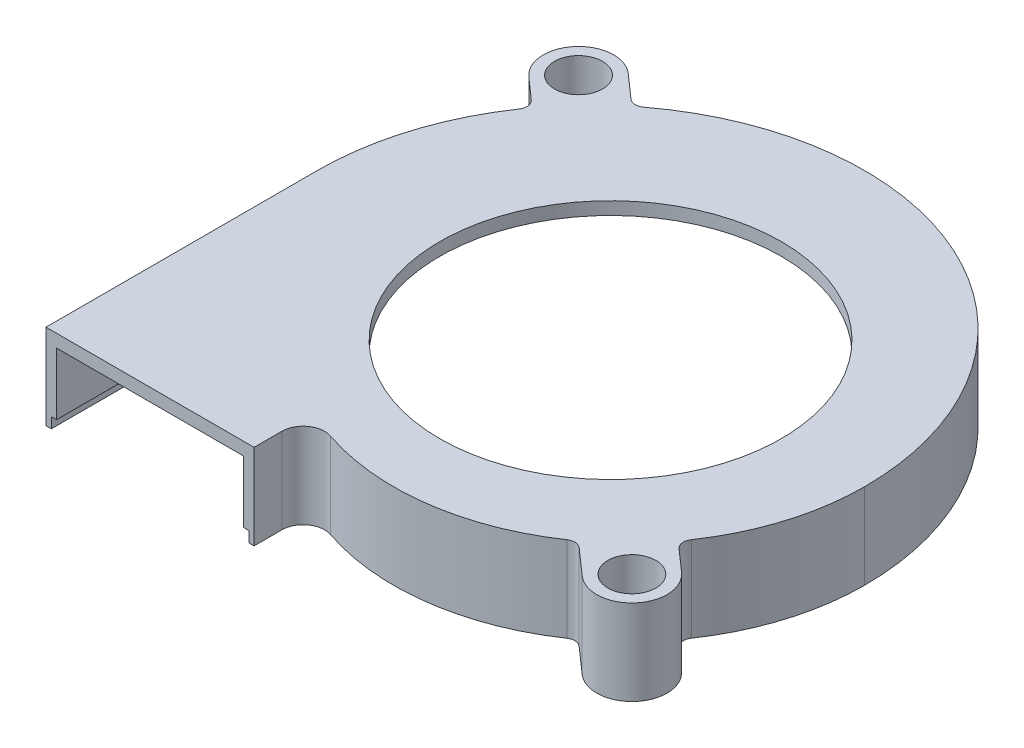
from build123d import *

# Parameters (mm, degrees)
SKETCH_1_R          = 16
SKETCH_1_R_2        = 2.25
EXTRUDE_1_DEPTH     = 8
CUT_EXTRUDE_1_DEPTH = 6.8
CUT_EXTRUDE_8_DEPTH = 1


with BuildPart() as part:
    # Эскиз1 → Бобышка-Вытянуть1 (new body)
    with BuildSketch(Plane(origin=(0, 0, 0), x_dir=(1, 0, 0), z_dir=(0, 1, 0))):
        with BuildLine():
            Line((-27.5, -25.4), (-8, -25.4))
            Line((-8, -25.4), (-8, -22.792302991))
            ThreePointArc((-8, -22.792302991), (-7.16511566, -21.166724479), (-5.357494501, -20.89831601))
            ThreePointArc((-5.357494501, -20.89831601), (4.710003701, -21.866199594), (14.151976117, -18.241220202))
            ThreePointArc((14.151976117, -18.241220202), (14.777726241, -18.069792078), (15.376980036, -18.318480053))
            Line((15.376980036, -18.318480053), (17.814747272, -20.472785982))
            ThreePointArc((17.814747272, -20.472785982), (22.472785982, -20.185252728), (22.185252728, -15.527214018))
            Line((22.185252728, -15.527214018), (20.143734708, -13.723081814))
            ThreePointArc((20.143734708, -13.723081814), (19.813719174, -13.098302749), (19.979075206, -12.411340949))
            ThreePointArc((19.979075206, -12.411340949), (22.823148445, -6.493089604), (23.8, 0))
            ThreePointArc((23.8, 0), (9.576401492, 22.98111988), (-17.333078903, 20.466663618))
            ThreePointArc((-17.333078903, 20.466663618), (-17.974550182, 20.264645495), (-18.598905377, 20.514600122))
            Line((-18.598905377, 20.514600122), (-20.814747272, 22.472785982))
            ThreePointArc((-20.814747272, 22.472785982), (-25.472785982, 22.185252728), (-25.185252728, 17.527214018))
            Line((-25.185252728, 17.527214018), (-23.20688118, 15.778885673))
            ThreePointArc((-23.20688118, 15.778885673), (-22.876796583, 15.153555184), (-23.04284729, 14.466226133))
            ThreePointArc((-23.04284729, 14.466226133), (-26.362874376, 7.569397218), (-27.5, 0))
            Line((-27.5, 0), (-27.5, -25.4))
        make_face()
        with Locations(Location((0, 0, 0), (0, 0, 270))):
            Circle(SKETCH_1_R, mode=Mode.SUBTRACT)
        with Locations(Location((-23, 20, 0), (0, 0, 270))):
            Circle(SKETCH_1_R_2, mode=Mode.SUBTRACT)
        with Locations(Location((20, -18, 0), (0, 0, 270))):
            Circle(SKETCH_1_R_2, mode=Mode.SUBTRACT)
    extrude(amount=-EXTRUDE_1_DEPTH)

    # Эскиз2 → Вырез-Вытянуть1 (cut)
    with BuildSketch(Plane(origin=(0, -8, 0), x_dir=(-1, 0, 0), z_dir=(0, -1, 0))):
        with BuildLine():
            Line((9, -25.4), (9, -22.792302991))
            ThreePointArc((9, -22.792302991), (7.74767349, -20.353935223), (5.036241751, -19.95132252))
            ThreePointArc((5.036241751, -19.95132252), (-4.575054369, -20.875347093), (-13.589169994, -17.414631267))
            ThreePointArc((-13.589169994, -17.414631267), (-16.632858543, -14.893819788), (-19.152217909, -11.84892917))
            ThreePointArc((-19.152217909, -11.84892917), (-21.867461922, -6.198703298), (-22.799999997, 0.000326884))
            ThreePointArc((-22.799999997, 0.000326884), (-9.131074658, 22.085751778), (16.729450225, 19.669398029))
            ThreePointArc((16.729450225, 19.669398029), (19.707335368, 17.009099388), (22.216615604, 13.902895678))
            ThreePointArc((22.216615604, 13.902895678), (25.407255273, 7.274792502), (26.500000107, 0.000327424))
            Line((26.500000107, 0.000327424), (26.5, -25.4))
            Line((26.5, -25.4), (9, -25.4))
        make_face()
    extrude(amount=-CUT_EXTRUDE_1_DEPTH, mode=Mode.SUBTRACT)

    # Эскиз11 → Вырез-Вытянуть8 (cut)
    with BuildSketch(Plane.XZ.offset(8)):
        with BuildLine():
            Line((-9, 22.792302991), (-9, 25.4))
            Line((-9, 25.4), (-8.5, 25.4))
            Line((-8.5, 25.4), (-8.5, 22.792302991))
            ThreePointArc((-8.5, 22.792302991), (-7.456394575, 20.760329851), (-5.196868126, 20.424819265))
            ThreePointArc((-5.196868126, 20.424819265), (14.296629108, 17.530257554), (23.3, -0.000122775))
            ThreePointArc((23.3, -0.000122775), (-1.849981192, -25.16680236), (-26.999999983, -0.000160392))
            Line((-26.999999983, -0.000160392), (-27.000000053, 25.4))
            Line((-27.000000053, 25.4), (-26.500000054, 25.4))
            Line((-26.500000054, 25.4), (-26.500000053, -0.000327424))
            ThreePointArc((-26.500000053, -0.000327424), (-1.849999809, -24.666802429), (22.799999998, -0.000327043))
            ThreePointArc((22.799999998, -0.000327043), (14.005433206, 17.123803427), (-5.036241751, 19.95132252))
            ThreePointArc((-5.036241751, 19.95132252), (-7.74767349, 20.353935223), (-9, 22.792302991))
        make_face()
    extrude(amount=-CUT_EXTRUDE_8_DEPTH, mode=Mode.SUBTRACT)


solid = part.part
